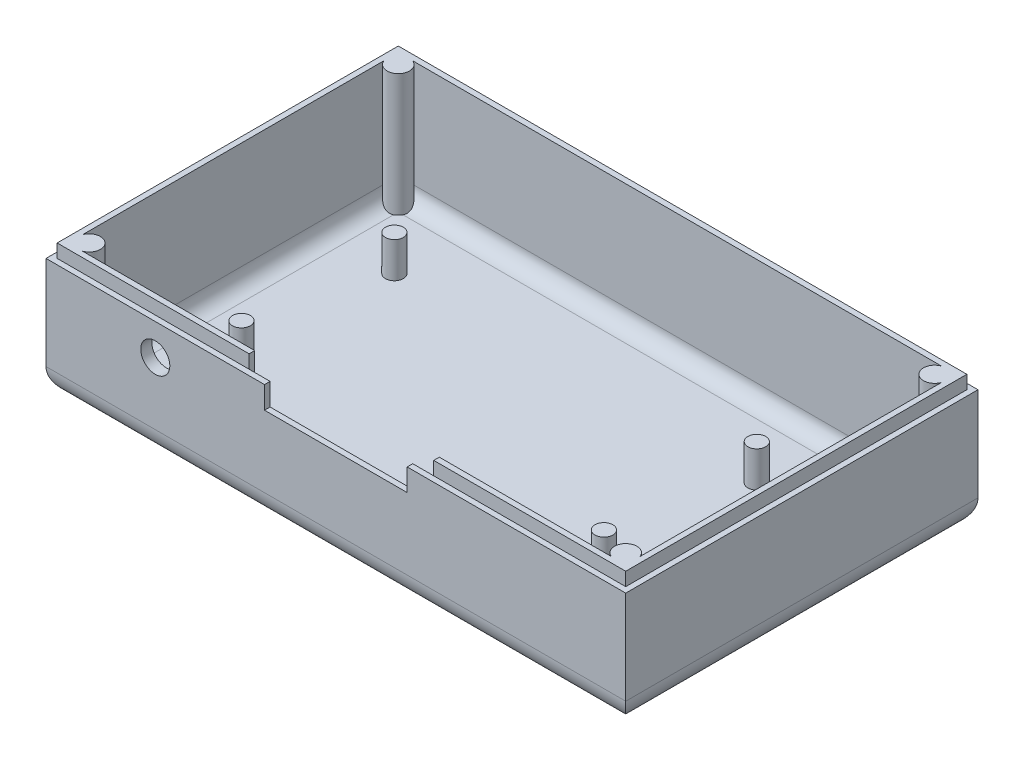
from build123d import *

# Parameters (mm, degrees)
SKETCH1_W           = 130
SKETCH1_H           = 79
BOSS_EXTRUDE1_DEPTH = 30
FILLET1_R           = 6
SHELL1_T            = -2.5
SKETCH2_W           = 130
SKETCH2_H           = 79
SKETCH2_W_2         = 127.5
SKETCH2_H_2         = 76.5
CUT_EXTRUDE1_DEPTH  = 3
SKETCH3_R           = 2
BOSS_EXTRUDE2_DEPTH = 8
BOSS_EXTRUDE3_REACH = 83.763
CUT_EXTRUDE2_REACH  = 108.611
SKETCH5_W           = 31.98
SKETCH5_H           = 7.98
SKETCH6_W           = 41.4
SKETCH6_H           = 24.3
CUT_EXTRUDE3_DEPTH  = 1.25
CUT_EXTRUDE4_REACH  = 108.611
SKETCH7_R           = 3.26


with BuildPart() as part:
    # Sketch1 → Boss-Extrude1 (new body)
    with BuildSketch(Plane(origin=(0, 0, 0), x_dir=(1, 0, 0), z_dir=(0, 1, 0))):
        Rectangle(SKETCH1_W, SKETCH1_H)
    extrude(amount=BOSS_EXTRUDE1_DEPTH)

    # Fillet1
    fillet1_edges = [part.edges().sort_by_distance(p)[0] for p in [
        (0, 0, 39.5),
        (-65, 0, 0),
        (0, 0, -39.5),
        (65, 0, 0),
    ]]
    fillet(fillet1_edges, radius=FILLET1_R)

    # Shell1
    shell1_openings = [part.faces().sort_by_distance(p)[0] for p in [
        (0, 30, 0),
    ]]
    offset(amount=SHELL1_T, openings=shell1_openings)

    # Sketch2 → Cut-Extrude1 (cut)
    with BuildSketch(Plane(origin=(0, 30, 0), x_dir=(1, 0, 0), z_dir=(0, 1, 0))):
        Rectangle(SKETCH2_W, SKETCH2_H)
        Rectangle(SKETCH2_W_2, SKETCH2_H_2, mode=Mode.SUBTRACT)
    extrude(amount=-CUT_EXTRUDE1_DEPTH, mode=Mode.SUBTRACT)

    # Sketch3 → Boss-Extrude2 (add)
    with BuildSketch(Plane(origin=(0, 2.5, 0), x_dir=(1, 0, 0), z_dir=(0, 1, 0))):
        with Locations(Location((-47.503765377, 21.122596556, 0), (0, 0, 90))):
            Circle(SKETCH3_R)
        with Locations(Location((33.776234623, 21.122596556, 0), (0, 0, 90))):
            Circle(SKETCH3_R)
        with Locations(Location((-47.503765377, -13.167403444, 0), (0, 0, 90))):
            Circle(SKETCH3_R)
        with Locations(Location((33.776234623, -13.167403444, 0), (0, 0, 90))):
            Circle(SKETCH3_R)
    extrude(amount=BOSS_EXTRUDE2_DEPTH)

    # Sketch4 → Boss-Extrude3 (add, up to next)
    with BuildSketch(Plane(origin=(0, 30, 0), x_dir=(1, 0, 0), z_dir=(0, 1, 0)), mode=Mode.PRIVATE) as boss_extrude3_sk1:
        with BuildLine():
            Line((-62.5, 37), (-62.5, 35.502936105))
            ThreePointArc((-62.5, 35.502936105), (-58.382233047, 32.882233047), (-61.002936105, 37))
            Line((-61.002936105, 37), (-62.5, 37))
        make_face()
    boss_extrude3_tool1 = extrude(boss_extrude3_sk1.sketch, amount=-BOSS_EXTRUDE3_REACH, mode=Mode.PRIVATE) - part.part
    # Sketch4 → Boss-Extrude3 (add, up to next)
    with BuildSketch(Plane(origin=(0, 30, 0), x_dir=(1, 0, 0), z_dir=(0, 1, 0)), mode=Mode.PRIVATE) as boss_extrude3_sk2:
        with BuildLine():
            Line((62.5, 37), (62.5, 35.502936105))
            ThreePointArc((62.5, 35.502936105), (58.382233047, 32.882233047), (61.002936105, 37))
            Line((61.002936105, 37), (62.5, 37))
        make_face()
    boss_extrude3_tool2 = extrude(boss_extrude3_sk2.sketch, amount=-BOSS_EXTRUDE3_REACH, mode=Mode.PRIVATE) - part.part
    # Sketch4 → Boss-Extrude3 (add, up to next)
    with BuildSketch(Plane(origin=(0, 30, 0), x_dir=(1, 0, 0), z_dir=(0, 1, 0)), mode=Mode.PRIVATE) as boss_extrude3_sk3:
        with BuildLine():
            Line((-62.5, -37), (-62.5, -35.502936105))
            ThreePointArc((-62.5, -35.502936105), (-58.382233047, -32.882233047), (-61.002936105, -37))
            Line((-61.002936105, -37), (-62.5, -37))
        make_face()
    boss_extrude3_tool3 = extrude(boss_extrude3_sk3.sketch, amount=-BOSS_EXTRUDE3_REACH, mode=Mode.PRIVATE) - part.part
    # Sketch4 → Boss-Extrude3 (add, up to next)
    with BuildSketch(Plane(origin=(0, 30, 0), x_dir=(1, 0, 0), z_dir=(0, 1, 0)), mode=Mode.PRIVATE) as boss_extrude3_sk4:
        with BuildLine():
            Line((62.5, -37), (61.002936105, -37))
            ThreePointArc((61.002936105, -37), (58.382233047, -32.882233047), (62.5, -35.502936105))
            Line((62.5, -35.502936105), (62.5, -37))
        make_face()
    boss_extrude3_tool4 = extrude(boss_extrude3_sk4.sketch, amount=-BOSS_EXTRUDE3_REACH, mode=Mode.PRIVATE) - part.part
    add(boss_extrude3_tool1.solids().sort_by_distance((-60.224191, 30, -34.724191))[0])
    add(boss_extrude3_tool2.solids().sort_by_distance((60.224191, 30, -34.724191))[0])
    add(boss_extrude3_tool3.solids().sort_by_distance((-60.224191, 30, 34.724191))[0])
    add(boss_extrude3_tool4.solids().sort_by_distance((60.224191, 30, 34.724191))[0])

    # Cut-Extrude2: up to this face of the body (flat: up to its plane)
    cut_extrude2_end = Plane(part.part.faces().sort_by_distance((0, 18, 37))[0])
    # Sketch5 → Cut-Extrude2 (cut, up to the picked face)
    with BuildSketch(Plane.XY.offset(39.5), mode=Mode.PRIVATE) as cut_extrude2_sk1:
        with Locations((0, 26.01)):
            Rectangle(SKETCH5_W, SKETCH5_H)
    cut_extrude2_tool1 = split(extrude(cut_extrude2_sk1.sketch, amount=-CUT_EXTRUDE2_REACH, mode=Mode.PRIVATE), bisect_by=cut_extrude2_end, keep=Keep.BOTH, mode=Mode.PRIVATE)
    add(cut_extrude2_tool1.solids().sort_by(Axis((0, 26.01, 39.5), (0, 0, -1)))[0], mode=Mode.SUBTRACT)

    # Sketch6 → Cut-Extrude3 (cut)
    with BuildSketch(Plane(origin=(0, 0, 37), x_dir=(-1, 0, 0), z_dir=(0, 0, -1))):
        with Locations((0, 22.66)):
            Rectangle(SKETCH6_W, SKETCH6_H)
    extrude(amount=-CUT_EXTRUDE3_DEPTH, mode=Mode.SUBTRACT)

    # Sketch7 → Cut-Extrude4 (cut, up to next)
    with BuildSketch(Plane.XY.offset(39.5), mode=Mode.PRIVATE) as cut_extrude4_sk1:
        with Locations((-40.495, 20)):
            Circle(SKETCH7_R)
    cut_extrude4_tool1 = extrude(cut_extrude4_sk1.sketch, amount=-CUT_EXTRUDE4_REACH, mode=Mode.PRIVATE) & part.part
    add(cut_extrude4_tool1.solids().sort_by_distance((-40.495, 20, 39.5))[0], mode=Mode.SUBTRACT)


solid = part.part
